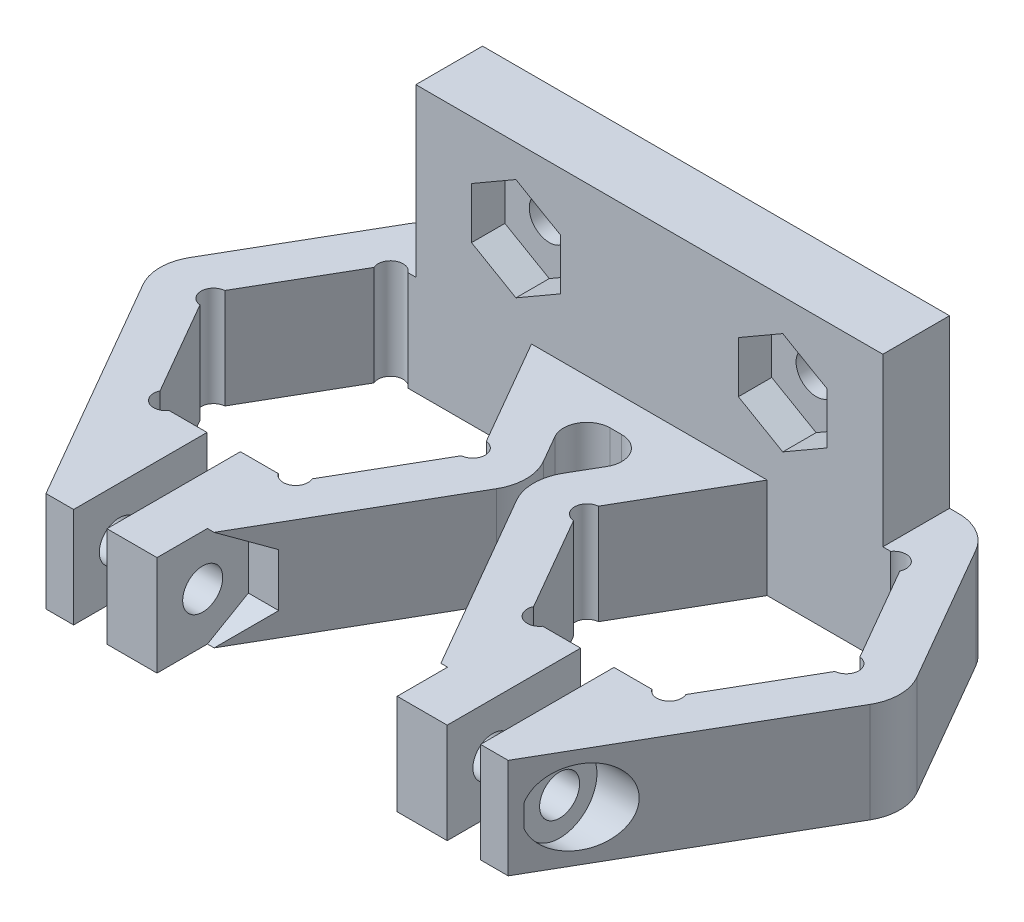
from build123d import *

# Parameters (mm, degrees)
BOSS_EXTRUDE1_DEPTH = 9.525
SKETCH2_W           = 22.225
SKETCH2_H           = 6.35
BOSS_EXTRUDE2_DEPTH = 15.875
CUT_EXTRUDE1_DEPTH  = 3.175
SKETCH4_R           = 1.905
CUT_EXTRUDE2_DEPTH  = 59.094809978
CUT_EXTRUDE4_DEPTH  = 44.225634179
SKETCH6_R           = 1.905
CUT_EXTRUDE5_DEPTH  = 44.225634179
SKETCH7_R           = 3.556
CUT_EXTRUDE6_DEPTH  = 43.561156261


with BuildPart() as part:
    # Sketch1 → Boss-Extrude1 (new body)
    with BuildSketch(Plane(origin=(0, 0, 0), x_dir=(1, 0, 0), z_dir=(0, 1, 0))):
        with BuildLine():
            Line((0, 16.129), (-23.095952604, 16.129))
            ThreePointArc((-23.095952604, 16.129), (-25.318452604, 15.53348292), (-26.945435523, 13.9065))
            Line((-26.945435523, 13.9065), (-34.607739621, 0.635))
            ThreePointArc((-34.607739621, 0.635), (-35.203256701, -1.5875), (-34.607739621, -3.81))
            Line((-34.607739621, -3.81), (-21.996100341, -25.654))
            Line((-21.996100341, -25.654), (-19.3675, -25.654))
            Line((-19.3675, -25.654), (-19.3675, -12.954))
            Line((-19.3675, -12.954), (-22.973435593, -12.954))
            ThreePointArc((-22.973435593, -12.954), (-24.540889335, -13.297703832), (-25.026959956, -11.768397157))
            Line((-25.026959956, -11.768397157), (-30.220395549, -2.773102843))
            ThreePointArc((-30.220395549, -2.773102843), (-31.301778669, -1.5875), (-30.220395549, -0.401897157))
            Line((-30.220395549, -0.401897157), (-25.026959956, 8.593397157))
            ThreePointArc((-25.026959956, 8.593397157), (-24.540889335, 10.122703832), (-22.973435593, 9.779))
            Line((-22.973435593, 9.779), (-11.217548165, 9.779))
            Line((-11.217548165, 9.779), (-5.339604451, -0.401897157))
            ThreePointArc((-5.339604451, -0.401897157), (-4.258221331, -1.5875), (-5.339604451, -2.773102843))
            Line((-5.339604451, -2.773102843), (-10.533040044, -11.768397157))
            ThreePointArc((-10.533040044, -11.768397157), (-11.019110665, -13.297703832), (-12.586564407, -12.954))
            Line((-12.586564407, -12.954), (-16.1925, -12.954))
            Line((-16.1925, -12.954), (-16.1925, -25.654))
            Line((-16.1925, -25.654), (-11.43, -25.654))
            Line((-11.43, -25.654), (-11.43, -21.957977372))
            Line((-11.43, -21.957977372), (-0.952260379, -3.81))
            ThreePointArc((-0.952260379, -3.81), (-0.356743299, -1.5875), (-0.952260379, 0.635))
            Line((-0.952260379, 0.635), (-2.473722676, 3.27025))
            ThreePointArc((-2.473722676, 3.27025), (-2.473722676, 5.49275), (-0.548981216, 6.604))
            Line((-0.548981216, 6.604), (0, 6.604))
            Line((0, 6.604), (0, 16.129))
        make_face()
    extrude(amount=BOSS_EXTRUDE1_DEPTH)

    # Sketch2 → Boss-Extrude2 (add)
    with BuildSketch(Plane(origin=(0, 9.525, 0), x_dir=(1, 0, 0), z_dir=(0, 1, 0))):
        with Locations((-11.1125, 12.954)):
            Rectangle(SKETCH2_W, SKETCH2_H)
    extrude(amount=BOSS_EXTRUDE2_DEPTH)

    # Sketch3 → Cut-Extrude1 (cut)
    with BuildSketch(Plane.XY.offset(-9.779)):
        Polygon((-8.47725, 15.024494151), (-8.47725, 19.900505849), (-12.7, 22.338511698), (-16.92275, 19.900505849), (-16.92275, 15.024494151), (-12.7, 12.586488302), align=None)
    extrude(amount=-CUT_EXTRUDE1_DEPTH, mode=Mode.SUBTRACT)

    # Sketch4 → Cut-Extrude2 (cut, through all)
    with BuildSketch(Plane.XY.offset(-12.954)):
        with Locations((-12.7, 17.4625)):
            Circle(SKETCH4_R)
    extrude(amount=-CUT_EXTRUDE2_DEPTH, mode=Mode.SUBTRACT)

    # Sketch5 → Cut-Extrude4 (cut, through all)
    with BuildSketch(Plane.ZY.offset(11.43)):
        Polygon((21.30425, 9.785158667), (28.06158587, 9.785158667), (28.06158587, -0.260158667), (21.30425, -0.260158667), (16.9545, 2.251170667), (16.9545, 7.273829333), align=None)
    extrude(amount=-CUT_EXTRUDE4_DEPTH, mode=Mode.SUBTRACT)

    # Sketch6 → Cut-Extrude5 (cut, through all)
    with BuildSketch(Plane(origin=(-11.43, 0, 0), x_dir=(0, 0, -1), z_dir=(1, 0, 0))):
        with Locations((-21.30425, 4.7625)):
            Circle(SKETCH6_R)
    extrude(amount=-CUT_EXTRUDE5_DEPTH, mode=Mode.SUBTRACT)

    # Sketch7 → Cut-Extrude6 (cut, through all)
    with BuildSketch(Plane(origin=(-22.5425, 0, 0), x_dir=(0, 0, -1), z_dir=(1, 0, 0))):
        with Locations((-21.30425, 4.7625)):
            Circle(SKETCH7_R)
    extrude(amount=-CUT_EXTRUDE6_DEPTH, mode=Mode.SUBTRACT)

    # Mirror1: part across plane


with BuildPart() as part_1:
    add(part.part)
    add(part.part.mirror(Plane(origin=(0, 9.525, 0), x_dir=(0, 0, 1), z_dir=(1, 0, 0))))


solid = part_1.part
